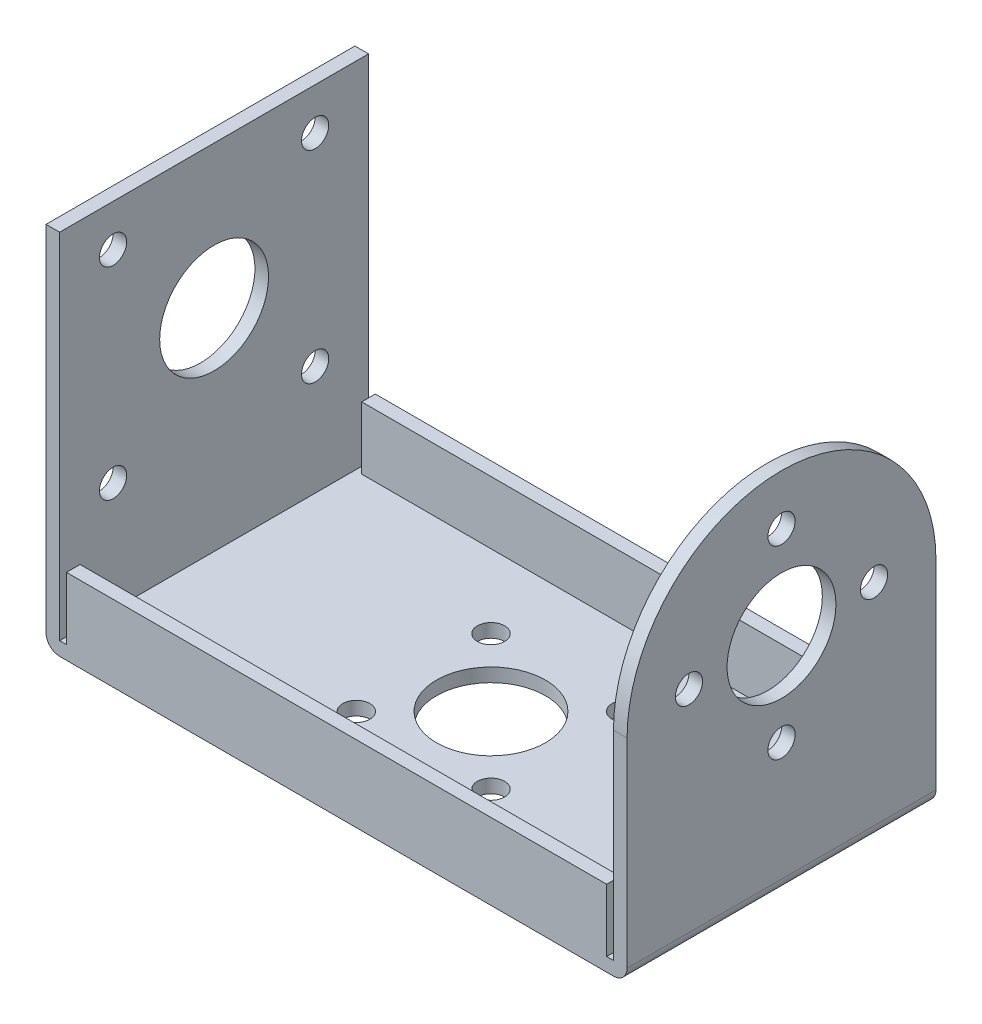
from build123d import *

# Parameters (mm, degrees)
SKETCH1_W           = 42.7
SKETCH1_H           = 22.7
SKETCH1_R           = 4
SKETCH1_R_2         = 1
BOSS_EXTRUDE1_DEPTH = 1
SKETCH2_W           = 1
SKETCH2_H           = 22.7
BOSS_EXTRUDE2_DEPTH = 26
SKETCH3_W           = 39.7
SKETCH3_H           = 1
BOSS_EXTRUDE3_DEPTH = 4.6
FILLET2_R           = 1
SKETCH4_R           = 4
SKETCH4_R_2         = 1
CUT_EXTRUDE1_DEPTH  = 1
CUT_EXTRUDE2_START  = -1
SKETCH5_R           = 1
SKETCH5_R_2         = 4
CUT_EXTRUDE2_DEPTH  = 1


with BuildPart() as part:
    # Sketch1 → Boss-Extrude1 (new body)
    with BuildSketch(Plane(origin=(0, 0, 0), x_dir=(1, 0, 0), z_dir=(0, 1, 0))):
        with Locations((21.35, 11.35)):
            Rectangle(SKETCH1_W, SKETCH1_H)
        with Locations(Location((21.35, 11.35, 0), (0, 0, 270))):
            Circle(SKETCH1_R, mode=Mode.SUBTRACT)
        with Locations(Location((26.299747468, 16.299747468, 0), (0, 0, 270))):
            Circle(SKETCH1_R_2, mode=Mode.SUBTRACT)
        with Locations(Location((26.299747468, 6.400252532, 0), (0, 0, 270))):
            Circle(SKETCH1_R_2, mode=Mode.SUBTRACT)
        with Locations(Location((16.400252532, 6.400252532, 0), (0, 0, 270))):
            Circle(SKETCH1_R_2, mode=Mode.SUBTRACT)
        with Locations(Location((16.400252532, 16.299747468, 0), (0, 0, 270))):
            Circle(SKETCH1_R_2, mode=Mode.SUBTRACT)
    extrude(amount=BOSS_EXTRUDE1_DEPTH)

    # Sketch2 → Boss-Extrude2 (add)
    with BuildSketch(Plane(origin=(0, 1, 0), x_dir=(1, 0, 0), z_dir=(0, 1, 0))):
        with Locations((0.5, 11.35)):
            Rectangle(SKETCH2_W, SKETCH2_H)
        with Locations((42.2, 11.35)):
            Rectangle(SKETCH2_W, SKETCH2_H)
    extrude(amount=BOSS_EXTRUDE2_DEPTH)

    # Sketch3 → Boss-Extrude3 (add)
    with BuildSketch(Plane(origin=(0, 1, 0), x_dir=(1, 0, 0), z_dir=(0, 1, 0))):
        with Locations((21.35, 22.2)):
            Rectangle(SKETCH3_W, SKETCH3_H)
        with Locations((21.35, 0.5)):
            Rectangle(SKETCH3_W, SKETCH3_H)
    extrude(amount=BOSS_EXTRUDE3_DEPTH)

    # Fillet2
    fillet2_edges = [part.edges().sort_by_distance(p)[0] for p in [
        (42.7, 0, -11.35),
        (0, 0, -11.35),
    ]]
    fillet(fillet2_edges, radius=FILLET2_R)

    # Sketch4 → Cut-Extrude1 (cut)
    with BuildSketch(Plane.ZY):
        with Locations((-11.35, 16.5)):
            Circle(SKETCH4_R)
        with Locations((-18.774621202, 23.924621202)):
            Circle(SKETCH4_R_2)
        with Locations((-3.925378798, 23.924621202)):
            Circle(SKETCH4_R_2)
        with Locations((-3.925378798, 9.075378798)):
            Circle(SKETCH4_R_2)
        with Locations((-18.774621202, 9.075378798)):
            Circle(SKETCH4_R_2)
    extrude(amount=-CUT_EXTRUDE1_DEPTH, mode=Mode.SUBTRACT)

    # Sketch5 → Cut-Extrude2 (cut)
    with BuildSketch(Plane(origin=(42.7, 0, 0), x_dir=(0, 0, -1), z_dir=(1, 0, 0)).offset(CUT_EXTRUDE2_START)):
        with BuildLine():
            Line((0, 27), (0, 15.65))
            ThreePointArc((0, 15.65), (3.324338034, 23.675661966), (11.35, 27))
            Line((11.35, 27), (0, 27))
        make_face()
        with BuildLine():
            Line((22.7, 27), (11.35, 27))
            ThreePointArc((11.35, 27), (19.375661966, 23.675661966), (22.7, 15.65))
            Line((22.7, 15.65), (22.7, 27))
        make_face()
        with Locations((11.35, 23.3)):
            Circle(SKETCH5_R)
        with Locations(Location((11.35, 16.5, 0), (0, 0, 180))):
            Circle(SKETCH5_R_2)
        with Locations((18.15, 16.5)):
            Circle(SKETCH5_R)
        with Locations((11.35, 9.7)):
            Circle(SKETCH5_R)
        with Locations((4.55, 16.5)):
            Circle(SKETCH5_R)
    extrude(amount=CUT_EXTRUDE2_DEPTH, mode=Mode.SUBTRACT)


solid = part.part
